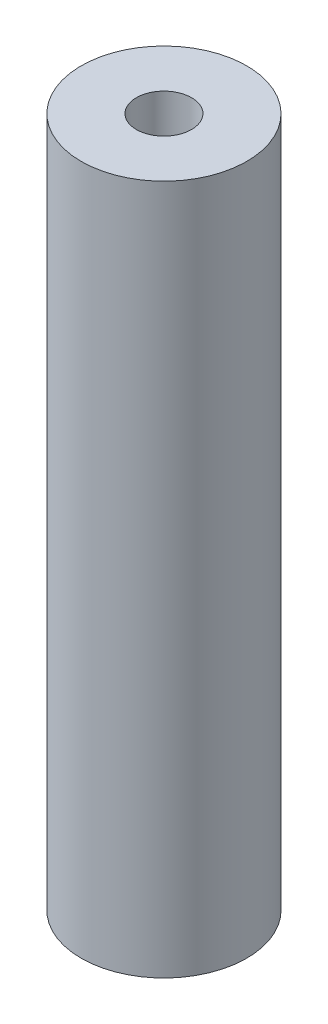
from build123d import *

# Parameters (mm, degrees)
SKICA1_W = 2
SKICA1_H = 25


with BuildPart() as part:
    # Skica1 → Rotovat1 (revolve)
    with BuildSketch(Plane(origin=(0, 0, 0), x_dir=(0, 0, -1), z_dir=(1, 0, 0)), mode=Mode.PRIVATE) as rotovat1_sk:
        with Locations((2, 0.968340643)):
            Rectangle(SKICA1_W, SKICA1_H)
    revolve(rotovat1_sk.sketch.rotate(Axis((0, 13.468340643, 0), (0, -1, 0)), 180), axis=Axis((0, 13.468340643, 0), (0, -1, 0)))


solid = part.part
